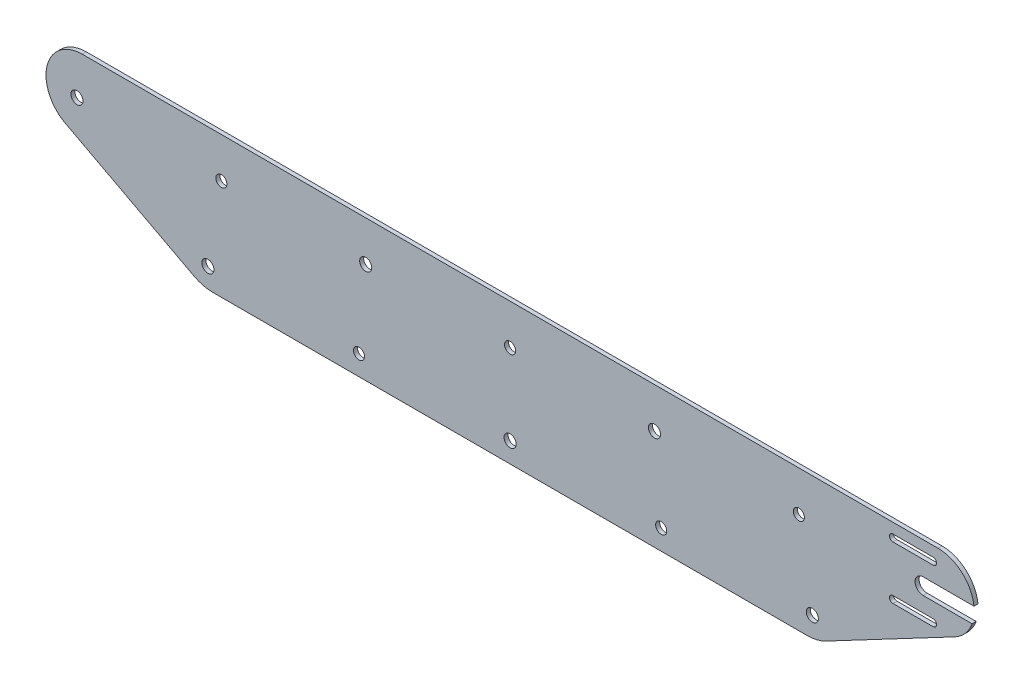
from build123d import *

# Parameters (mm, degrees)
ESQUISSE1_R             = 3
BOSS_EXTRU_1_DEPTH      = 2
CONG_1_R                = 18
CONG_2_R                = 20
D_GAGEMENT_M31_D        = 3.4
ENL_V_MAT_EXTRU_1_DEPTH = 234.819122898
D_GAGEMENT_M51_D        = 5.5
D_GAGEMENT_M52_D        = 5.5


with BuildPart() as part:
    # Esquisse1 → Boss.-Extru.1 (new body)
    with BuildSketch(Plane.XY):
        Polygon((-284.958991582, 40), (-150, 40), (150, 40), (284.958991582, 40), (152.479495791, -30), (-152.479495791, -30), align=None)
        with Locations((-215, 20)):
            Circle(ESQUISSE1_R, mode=Mode.SUBTRACT)
        with Locations((-150, -20)):
            Circle(ESQUISSE1_R, mode=Mode.SUBTRACT)
        with Locations((150, -20)):
            Circle(ESQUISSE1_R, mode=Mode.SUBTRACT)
        with Locations((215, 20)):
            Circle(ESQUISSE1_R, mode=Mode.SUBTRACT)
        with Locations((0, -20)):
            Circle(ESQUISSE1_R, mode=Mode.SUBTRACT)
        with Locations((-71.666666667, 20)):
            Circle(ESQUISSE1_R, mode=Mode.SUBTRACT)
        with Locations((71.666666667, 20)):
            Circle(ESQUISSE1_R, mode=Mode.SUBTRACT)
    extrude(amount=BOSS_EXTRU_1_DEPTH)

    # Congé1
    cong_1_edges = [part.edges().sort_by_distance(p)[0] for p in [
        (-284.958991582, 40, 1),
        (284.958991582, 40, 1),
    ]]
    fillet(cong_1_edges, radius=CONG_1_R)

    # Congé2
    cong_2_edges = [part.edges().sort_by_distance(p)[0] for p in [
        (152.479495791, -30, 1),
        (-152.479495791, -30, 1),
    ]]
    fillet(cong_2_edges, radius=CONG_2_R)

    # Dégagement M31 (through all)
    with Locations(Plane(origin=(0, 0, 0), x_dir=(-1, 0, 0), z_dir=(0, 0, -1))):
        with Locations((-200, 33.228756555), (-200, 6.771243445)):
            Hole(D_GAGEMENT_M31_D / 2)

    # Esquisse4 → Enlèv. mat.-Extru.1 (cut, through all)
    with BuildSketch(Plane(origin=(0, 0, 0), x_dir=(-1, 0, 0), z_dir=(0, 0, -1))):
        with BuildLine():
            Line((-229.334149786, 16), (-205, 16))
            ThreePointArc((-205, 16), (-201, 20), (-205, 24))
            Line((-205, 24), (-230.252130857, 24))
            ThreePointArc((-230.252130857, 24), (-230.246241418, 19.948007721), (-229.334149786, 16))
        make_face()
        with BuildLine():
            Line((-210, 31.528756555), (-190, 31.528756555))
            ThreePointArc((-190, 31.528756555), (-188.3, 33.228756555), (-190, 34.928756555))
            Line((-190, 34.928756555), (-210, 34.928756555))
            ThreePointArc((-210, 34.928756555), (-211.7, 33.228756555), (-210, 31.528756555))
        make_face()
        with BuildLine():
            Line((-210, 5.071243445), (-190, 5.071243445))
            ThreePointArc((-190, 5.071243445), (-188.3, 6.771243445), (-190, 8.471243445))
            Line((-190, 8.471243445), (-210, 8.471243445))
            ThreePointArc((-210, 8.471243445), (-211.7, 6.771243445), (-210, 5.071243445))
        make_face()
    extrude(amount=-ENL_V_MAT_EXTRU_1_DEPTH, mode=Mode.SUBTRACT)

    # Dégagement M51 (through all)
    with Locations(Plane(origin=(0, 0, 0), x_dir=(-1, 0, 0), z_dir=(0, 0, -1))):
        with Locations((143.333333333, 20), (0, 20), (-143.333333333, 20)):
            Hole(D_GAGEMENT_M51_D / 2)

    # Dégagement M52 (through all)
    with Locations(Plane.XY.offset(2)):
        with Locations((-75, -20), (75, -20)):
            Hole(D_GAGEMENT_M52_D / 2)


solid = part.part
